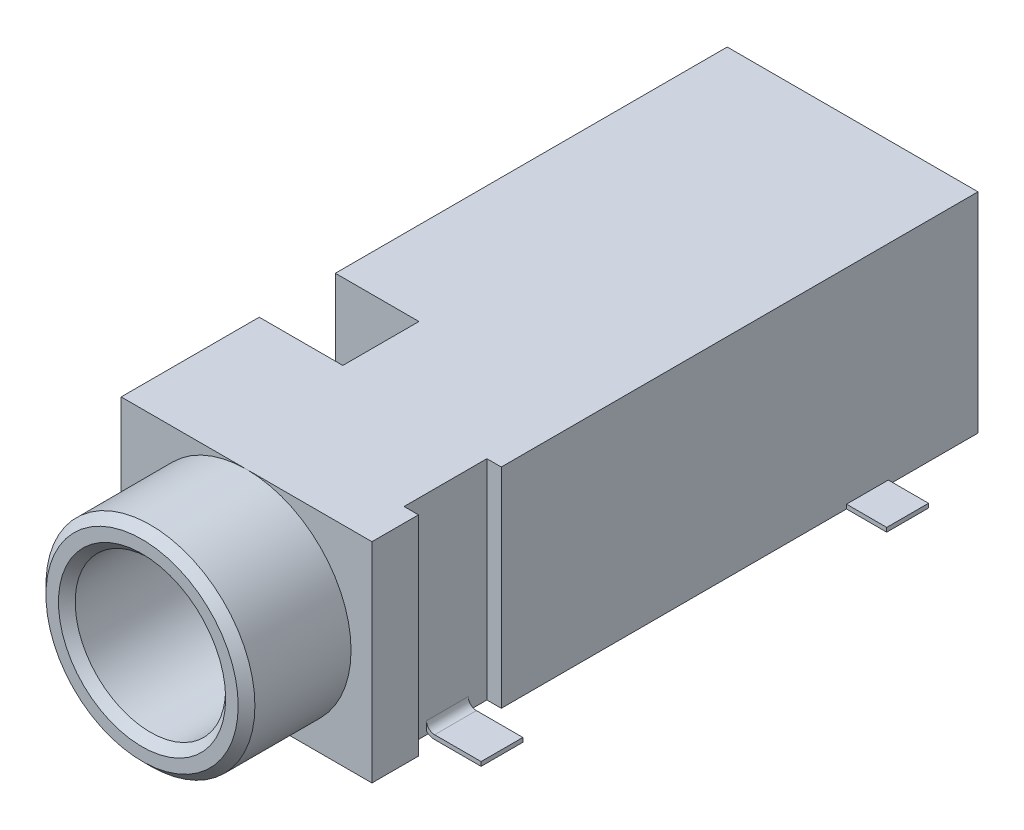
from build123d import *

# Parameters (mm, degrees)
SKETCH2_W                = 6
SKETCH2_H                = 14.5
BOSS_EXTRUDE1_DEPTH      = 5
SKETCH3_R                = 2.5
SKETCH3_R_2              = 1.8
BOSS_EXTRUDE2_DEPTH      = 2.5
CHAMFER2_SIZE            = 0.2
CHAMFER3_SIZE            = 0.2
CUT_EXTRUDE1_START       = -14.02
SKETCH4_R                = 1.8
CUT_EXTRUDE1_DEPTH       = 14.02
SKETCH5_R                = 0.75
BOSS_EXTRUDE3_DEPTH      = 0.75
FILLET1_R                = 0.2
SKETCH7_W                = 0.344908333
SKETCH7_H                = 1.981698852
CUT_EXTRUDE2_DEPTH       = 12.710038429
SURFACE_EXTRUDE1_1_BACK  = 0.5
SURFACE_EXTRUDE1_1_DEPTH = 1
THICKEN1_T1              = 0.1
SKETCH9_W                = 1
SKETCH9_H                = 0.1
BOSS_EXTRUDE4_DEPTH      = 0.961518788
SURFACE_EXTRUDE2_2_BACK  = 0.5
SURFACE_EXTRUDE2_2_DEPTH = 1
THICKEN2_T2              = 0.1
SKETCH11_W               = 1.821073917
SKETCH11_H               = 5.660094607
CUT_EXTRUDE3_DEPTH       = 2


with BuildPart() as part:
    # Sketch2 → Boss-Extrude1 (new body)
    with BuildSketch(Plane(origin=(0, 0, 0), x_dir=(1, 0, 0), z_dir=(0, 1, 0))):
        Rectangle(SKETCH2_W, SKETCH2_H)
    extrude(amount=BOSS_EXTRUDE1_DEPTH)

    # Sketch3 → Boss-Extrude2 (add)
    with BuildSketch(Plane.XY.offset(7.25)):
        with Locations(Location((0, 2.5, 0), (0, 0, 270))):
            Circle(SKETCH3_R)
        with Locations((0, 2.5)):
            Circle(SKETCH3_R_2, mode=Mode.SUBTRACT)
    extrude(amount=BOSS_EXTRUDE2_DEPTH)

    # Chamfer2
    chamfer2_edges = [part.edges().sort_by_distance(p)[0] for p in [
        (0, 5, 9.75),
    ]]
    chamfer(chamfer2_edges, length=CHAMFER2_SIZE)

    # Chamfer3
    chamfer3_edges = [part.edges().sort_by_distance(p)[0] for p in [
        (-1.8, 2.5, 9.75),
    ]]
    chamfer(chamfer3_edges, length=CHAMFER3_SIZE)

    # Sketch4 → Cut-Extrude1 (cut)
    with BuildSketch(Plane.XY.offset(7.25).offset(CUT_EXTRUDE1_START)):
        with Locations((0, 2.5)):
            Circle(SKETCH4_R)
    extrude(amount=CUT_EXTRUDE1_DEPTH, mode=Mode.SUBTRACT)

    # Sketch5 → Boss-Extrude3 (add)
    with BuildSketch(Plane.XZ):
        with Locations(Location((0, 4.191398765, 0), (0, 0, 90))):
            Circle(SKETCH5_R)
        with Locations(Location((0, -3.600413433, 0), (0, 0, 90))):
            Circle(SKETCH5_R)
    extrude(amount=BOSS_EXTRUDE3_DEPTH)

    # Fillet1
    fillet1_edges = [part.edges().sort_by_distance(p)[0] for p in [
        (0, -0.75, 3.441398765),
        (0, -0.75, -4.350413433),
    ]]
    fillet(fillet1_edges, radius=FILLET1_R)

    # Sketch7 → Cut-Extrude2 (cut, through all)
    with BuildSketch(Plane(origin=(0, 5, 0), x_dir=(1, 0, 0), z_dir=(0, 1, 0))):
        with Locations((2.827545834, -5.146058424)):
            Rectangle(SKETCH7_W, SKETCH7_H)
    extrude(amount=-CUT_EXTRUDE2_DEPTH, mode=Mode.SUBTRACT)

    # Surface-Extrude1: a surface, the sketch's curves swept straight by 1 mm
    with BuildLine(Plane.XY.offset(5.1).offset(-SURFACE_EXTRUDE1_1_BACK), mode=Mode.PRIVATE) as surface_extrude1_1_path:
        Line((2.555091667, 0.638024488), (2.555091667, 0.294273869))
        ThreePointArc((2.555091667, 0.294273869), (2.641282487, 0.086190821), (2.849365536, 0))
        Line((2.849365536, 0), (3.961518788, 0))
    surface_extrude1_1 = Shell.extrude(surface_extrude1_1_path.wire(), (0 * SURFACE_EXTRUDE1_1_DEPTH, 0 * SURFACE_EXTRUDE1_1_DEPTH, 1 * SURFACE_EXTRUDE1_1_DEPTH))
    add(Solid.thicken(surface_extrude1_1, THICKEN1_T1))

    # Sketch9 → Boss-Extrude4 (add)
    with BuildSketch(Plane(origin=(3, 0, 0), x_dir=(0, 0, -1), z_dir=(1, 0, 0))):
        with Locations((4.604659924, 0.05)):
            Rectangle(SKETCH9_W, SKETCH9_H)
    extrude(amount=BOSS_EXTRUDE4_DEPTH)

    # Surface-Extrude2: a surface, the sketch's curves swept straight by 1 mm
    with BuildLine(Plane.ZY.offset(-SURFACE_EXTRUDE2_2_BACK), mode=Mode.PRIVATE) as surface_extrude2_2_path:
        Line((-7.25, 2.862656565), (-7.25, 0.652010512))
        ThreePointArc((-7.25, 0.652010512), (-7.440969458, 0.190969458), (-7.902010512, 0))
        Line((-7.902010512, 0), (-9.009741204, 0))
    surface_extrude2_2 = Shell.extrude(surface_extrude2_2_path.wire(), (-1 * SURFACE_EXTRUDE2_2_DEPTH, 0 * SURFACE_EXTRUDE2_2_DEPTH, 0 * SURFACE_EXTRUDE2_2_DEPTH))
    add(Solid.thicken(surface_extrude2_2, -THICKEN2_T2))

    # Sketch11 → Cut-Extrude3 (cut)
    with BuildSketch(Plane.ZY.offset(3)):
        with Locations((3.036115989, 3.2980341)):
            Rectangle(SKETCH11_W, SKETCH11_H)
    extrude(amount=-CUT_EXTRUDE3_DEPTH, mode=Mode.SUBTRACT)


solid = part.part
